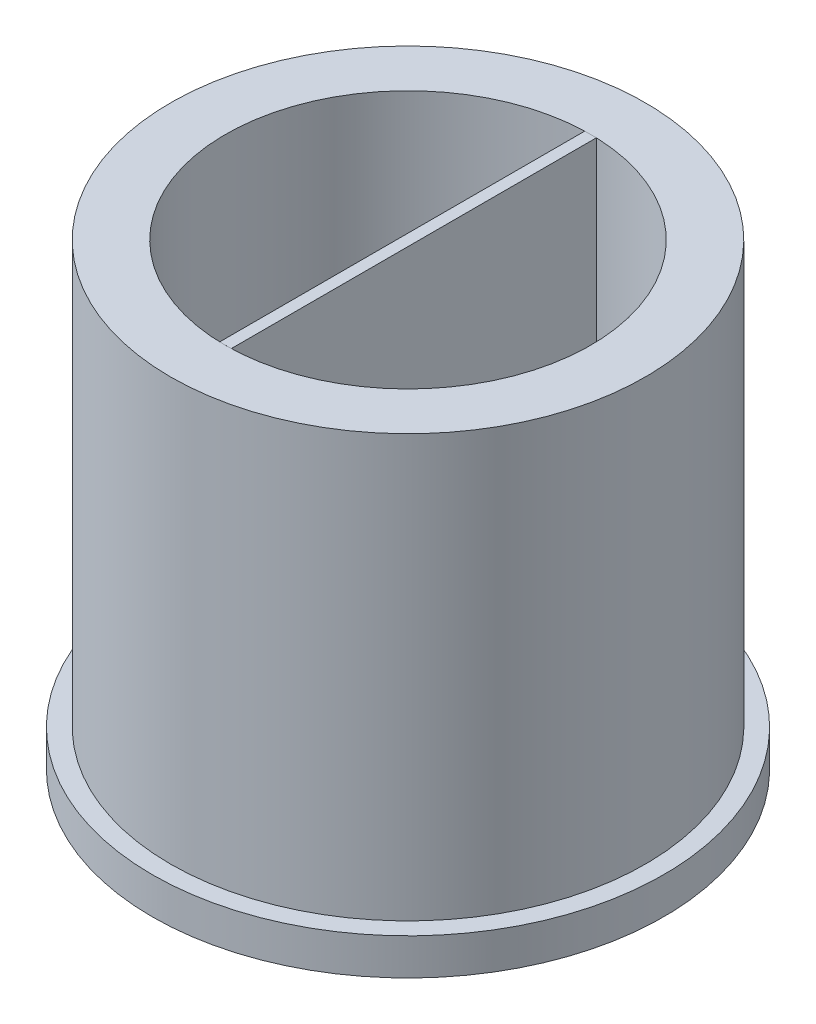
from build123d import *

# Parameters (mm, degrees)
SKETCH1_R            = 130
BOSS_EXTRUDE1_DEPTH  = 241.01
SKETCH2_R            = 100
CUT_EXTRUDE1_DEPTH   = 304.126739335
SKETCH5_W            = 6.35
SKETCH5_H            = 199.899168332
BOSS_EXTRUDE2_DEPTH  = 241.01
SKETCH6_R            = 140
BOSS_EXTRUDE8_DEPTH  = 10
SKETCH8_R            = 140
SKETCH8_R_2          = 130
BOSS_EXTRUDE10_DEPTH = 10


with BuildPart() as part:
    # Sketch1 → Boss-Extrude1 (new body)
    with BuildSketch(Plane(origin=(0, 0, 0), x_dir=(1, 0, 0), z_dir=(0, 1, 0))):
        Circle(SKETCH1_R)
    extrude(amount=BOSS_EXTRUDE1_DEPTH)

    # Sketch2 → Cut-Extrude1 (cut, through all)
    with BuildSketch(Plane(origin=(0, 241.01, 0), x_dir=(1, 0, 0), z_dir=(0, 1, 0))):
        Circle(SKETCH2_R)
    extrude(amount=-CUT_EXTRUDE1_DEPTH, mode=Mode.SUBTRACT)


with BuildPart() as body_2:
    # Sketch5 → Boss-Extrude2 (new body)
    with BuildSketch(Plane(origin=(0, 0, 0), x_dir=(1, 0, 0), z_dir=(0, 1, 0))):
        Rectangle(SKETCH5_W, SKETCH5_H)
    extrude(amount=BOSS_EXTRUDE2_DEPTH)


with BuildPart() as body_3:
    # Sketch6 → Boss-Extrude8 (new body)
    with BuildSketch(Plane(origin=(0, 0, 0), x_dir=(1, 0, 0), z_dir=(0, 1, 0))):
        Circle(SKETCH6_R)
    extrude(amount=-BOSS_EXTRUDE8_DEPTH)


with BuildPart() as body_4:
    # Sketch8 → Boss-Extrude10 (new body)
    with BuildSketch(Plane(origin=(0, 0, 0), x_dir=(1, 0, 0), z_dir=(0, 1, 0))):
        Circle(SKETCH8_R)
        Circle(SKETCH8_R_2, mode=Mode.SUBTRACT)
    extrude(amount=BOSS_EXTRUDE10_DEPTH)


with BuildPart() as body_3_1:
    add(body_3.part)

    # Combine1: union body 4
    add(body_4.part)


solid = Compound([part.part, body_2.part, body_3_1.part])
